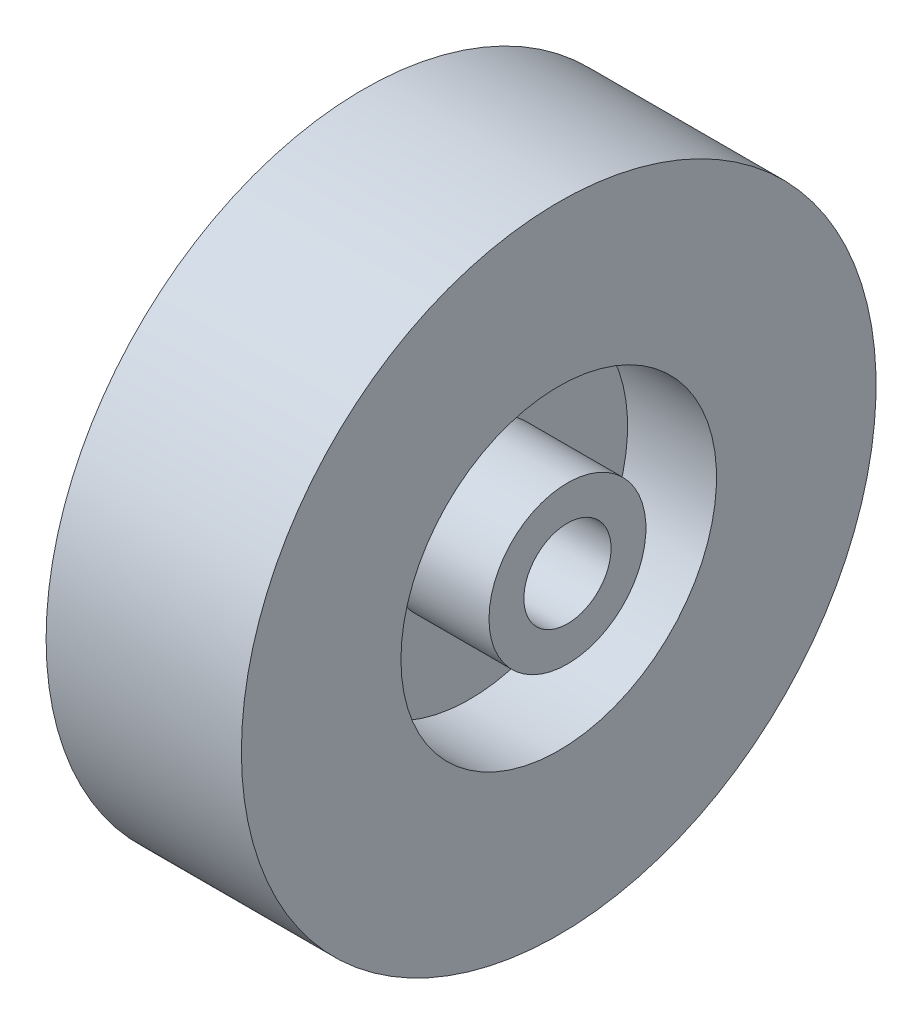
from build123d import *

# Parameters (mm, degrees)
SKETCH2_R          = 5
CUT_EXTRUDE1_DEPTH = 15


with BuildPart() as part:
    # Sketch1 → Revolve1 (revolve)
    with BuildSketch(Plane.XY, mode=Mode.PRIVATE) as revolve1_sk:
        Polygon((-11.2, 18.1), (-1, 18.1), (-1, 9), (-12.2, 9), (-12.2, 0), (12.2, 0), (12.2, 9), (1, 9), (1, 18.1), (11.2, 18.1), (11.2, 36.4), (-11.2, 36.4), align=None)
    revolve(revolve1_sk.sketch.rotate(Axis((0, 0, 0), (1, 0, 0)), 90), axis=Axis((0, 0, 0), (1, 0, 0)))

    # Sketch2 → Cut-Extrude1 (cut)
    with BuildSketch(Plane(origin=(12.2, 0, 0), x_dir=(0, 0, -1), z_dir=(1, 0, 0))):
        Circle(SKETCH2_R)
    extrude(amount=-CUT_EXTRUDE1_DEPTH, mode=Mode.SUBTRACT)


solid = part.part
